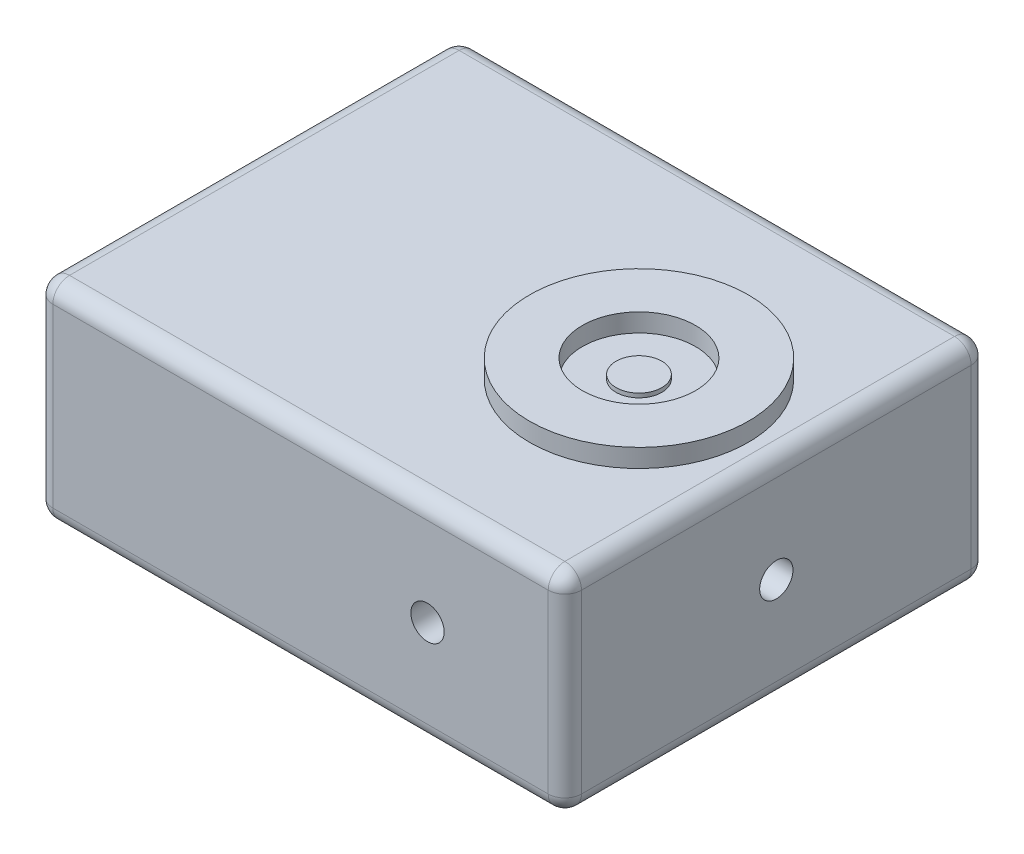
from build123d import *

# Parameters (mm, degrees)
SKETCH1_W           = 63.5
SKETCH1_H           = 50.8
BOSS_EXTRUDE1_DEPTH = 25.2
SKETCH2_R           = 13.1445
SKETCH2_R_2         = 6.7945
BOSS_EXTRUDE2_DEPTH = 2.2
SKETCH3_R           = 2
CUT_EXTRUDE1_DEPTH  = 5.5
SKETCH4_R           = 2
CUT_EXTRUDE2_DEPTH  = 5.5
CUT_EXTRUDE3_START  = -5.5
SKETCH5_R           = 2
CUT_EXTRUDE3_DEPTH  = 5.5
FILLET1_R           = 2
SKETCH6_W           = 18
SKETCH6_H           = 12
BOSS_EXTRUDE3_DEPTH = 1
SKETCH7_R           = 2.75
BOSS_EXTRUDE4_DEPTH = 0.5


with BuildPart() as part:
    # Sketch1 → Boss-Extrude1 (new body)
    with BuildSketch(Plane(origin=(0, 0, 0), x_dir=(1, 0, 0), z_dir=(0, 1, 0))):
        Rectangle(SKETCH1_W, SKETCH1_H)
    extrude(amount=BOSS_EXTRUDE1_DEPTH)

    # Sketch2 → Boss-Extrude2 (add)
    with BuildSketch(Plane(origin=(0, 25.2, 0), x_dir=(1, 0, 0), z_dir=(0, 1, 0))):
        with Locations(Location((15.25, 0, 0), (0, 0, 90))):
            Circle(SKETCH2_R)
        with Locations(Location((15.25, 0, 0), (0, 0, 270))):
            Circle(SKETCH2_R_2, mode=Mode.SUBTRACT)
    extrude(amount=BOSS_EXTRUDE2_DEPTH)

    # Sketch3 → Cut-Extrude1 (cut)
    with BuildSketch(Plane.XY.offset(25.4)):
        with Locations((15.25, 12.6)):
            Circle(SKETCH3_R)
    extrude(amount=-CUT_EXTRUDE1_DEPTH, mode=Mode.SUBTRACT)

    # Sketch4 → Cut-Extrude2 (cut)
    with BuildSketch(Plane(origin=(31.75, 0, 0), x_dir=(0, 0, -1), z_dir=(1, 0, 0))):
        with Locations((0, 12.6)):
            Circle(SKETCH4_R)
    extrude(amount=-CUT_EXTRUDE2_DEPTH, mode=Mode.SUBTRACT)

    # Sketch5 → Cut-Extrude3 (cut)
    with BuildSketch(Plane(origin=(0, 0, -25.4), x_dir=(-1, 0, 0), z_dir=(0, 0, -1)).offset(CUT_EXTRUDE3_START)):
        with Locations(Location((-15.25, 12.6, 0), (0, 0, 180))):
            Circle(SKETCH5_R)
    extrude(amount=CUT_EXTRUDE3_DEPTH, mode=Mode.SUBTRACT)

    # Fillet1
    fillet1_edges = [part.edges().sort_by_distance(p)[0] for p in [
        (-31.75, 25.2, 0),
        (0, 25.2, 25.4),
        (31.75, 25.2, 0),
        (0, 0, 25.4),
        (-31.75, 0, 0),
        (0, 0, -25.4),
        (31.75, 0, 0),
        (0, 25.2, -25.4),
        (31.75, 12.6, 25.4),
        (-31.75, 12.6, 25.4),
        (-31.75, 12.6, -25.4),
        (31.75, 12.6, -25.4),
    ]]
    fillet(fillet1_edges, radius=FILLET1_R)

    # Sketch6 → Boss-Extrude3 (add)
    with BuildSketch(Plane(origin=(0, 0, -25.4), x_dir=(-1, 0, 0), z_dir=(0, 0, -1))):
        with Locations((16.25, 8.5)):
            Rectangle(SKETCH6_W, SKETCH6_H)
    extrude(amount=BOSS_EXTRUDE3_DEPTH)

    # Sketch7 → Boss-Extrude4 (add)
    with BuildSketch(Plane(origin=(0, 25.2, 0), x_dir=(1, 0, 0), z_dir=(0, 1, 0))):
        with Locations(Location((15.25, 0, 0), (0, 0, 90))):
            Circle(SKETCH7_R)
    extrude(amount=BOSS_EXTRUDE4_DEPTH)


solid = part.part
